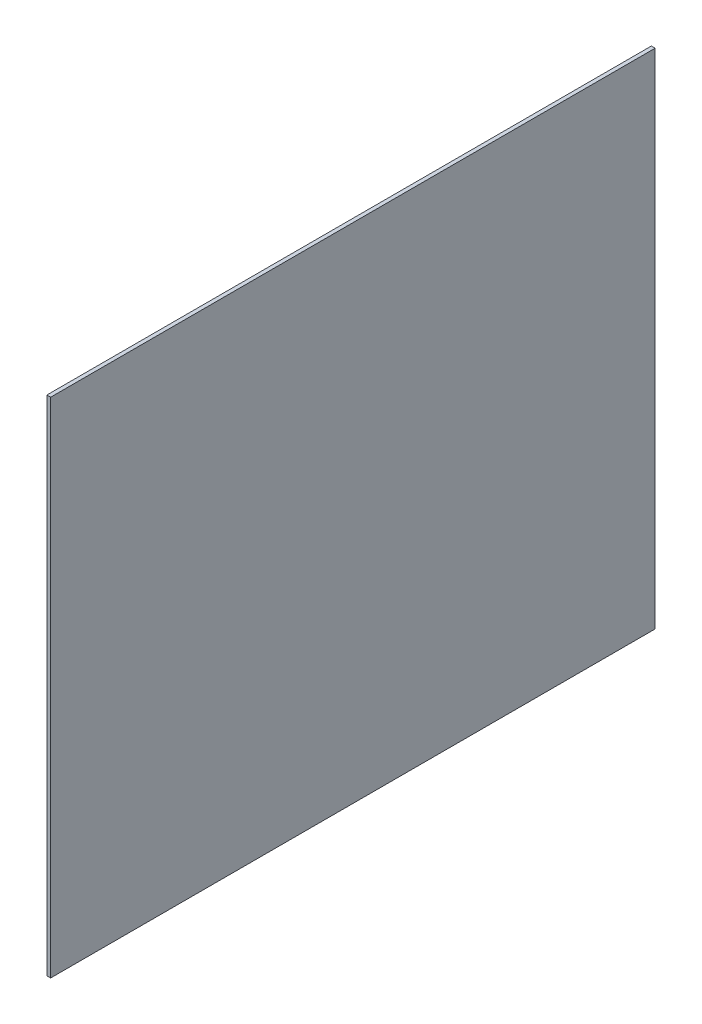
from build123d import *

# Parameters (mm, degrees)
BOSS_EXTRUDE1_START = -2000
SKETCH1_W           = 25
SKETCH1_H           = 3328.319603618
BOSS_EXTRUDE1_DEPTH = 4000


with BuildPart() as part:
    # Sketch1 → Boss-Extrude1 (new body)
    with BuildSketch(Plane.XY.offset(BOSS_EXTRUDE1_START)):
        Rectangle(SKETCH1_W, SKETCH1_H)
    extrude(amount=BOSS_EXTRUDE1_DEPTH)


solid = part.part
